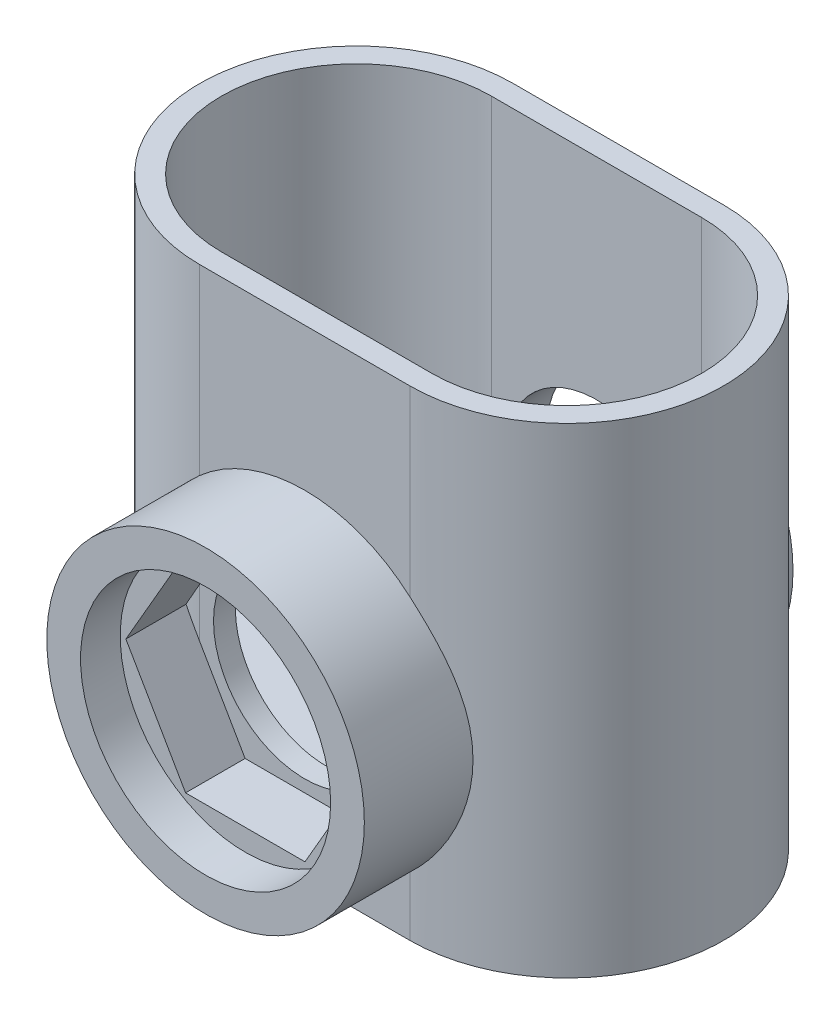
from build123d import *

# Parameters (mm, degrees)
EXTRUDE_1_DEPTH     = 24.2
EXTRUDE_2_REACH     = 38.885
SKETCH_2_R          = 8
SKETCH_7_R          = 6.3
CUT_EXTRUDE_5_DEPTH = 2
SKETCH_8_R          = 4.6
CUT_EXTRUDE_6_DEPTH = 37.885363123
EXTRUDE_START       = 1
SKETCH_8_3_R        = 7.8
SKETCH_8_3_R_2      = 4.6
EXTRUDE_3_DEPTH     = 1
CUT_EXTRUDE_7_DEPTH = 22.6


with BuildPart() as part:
    # 草圖1 → 填料-伸長1 (new body)
    with BuildSketch(Plane(origin=(0, 0, 0), x_dir=(1, 0, 0), z_dir=(0, 1, 0))):
        with BuildLine():
            Line((0, 7.9), (10.6, 7.9))
            ThreePointArc((10.6, 7.9), (18.5, 0), (10.6, -7.9))
            Line((10.6, -7.9), (0, -7.9))
            ThreePointArc((0, -7.9), (-7.9, 0), (0, 7.9))
        make_face()
    extrude(amount=EXTRUDE_1_DEPTH)

    # 草圖2 → 填料-伸長2 (add, up to next)
    with BuildSketch(Plane.XY.offset(12.9), mode=Mode.PRIVATE) as extrude_2_sk1:
        with Locations((5.3, 9)):
            Circle(SKETCH_2_R)
        Polygon((8.307994902, 14.21), (2.292005098, 14.21), (-0.715989805, 9), (2.292005098, 3.79), (8.307994902, 3.79), (11.315989805, 9), align=None, mode=Mode.SUBTRACT)
    extrude_2_tool1 = extrude(extrude_2_sk1.sketch, amount=-EXTRUDE_2_REACH, mode=Mode.PRIVATE) - part.part
    add(extrude_2_tool1.solids().sort_by_distance((-2.473726, 9, 12.9))[0])

    # 草圖7 → 除料-伸長5 (cut)
    with BuildSketch(Plane.XY.offset(12.9)):
        with Locations((5.3, 9)):
            Circle(SKETCH_7_R)
    extrude(amount=-CUT_EXTRUDE_5_DEPTH, mode=Mode.SUBTRACT)

    # 草圖8 → 除料-伸長6 (cut, through all)
    with BuildSketch(Plane(origin=(0, 0, -7.9), x_dir=(-1, 0, 0), z_dir=(0, 0, -1))):
        with Locations((-5.3, 9)):
            Circle(SKETCH_8_R)
    extrude(amount=-CUT_EXTRUDE_6_DEPTH, mode=Mode.SUBTRACT)

    # 草圖8<3> → 填料-伸長3 (add)
    with BuildSketch(Plane(origin=(0, 0, -7.9), x_dir=(-1, 0, 0), z_dir=(0, 0, -1)).offset(EXTRUDE_START)):
        with Locations((-5.3, 9)):
            Circle(SKETCH_8_3_R)
        with Locations((-5.3, 9)):
            Circle(SKETCH_8_3_R_2, mode=Mode.SUBTRACT)
    extrude(amount=-EXTRUDE_3_DEPTH)

    # 草圖9 → 除料-伸長7 (cut)
    with BuildSketch(Plane(origin=(0, 24.2, 0), x_dir=(1, 0, 0), z_dir=(0, 1, 0))):
        with BuildLine():
            ThreePointArc((10.6, -6.8), (17.4, 0), (10.6, 6.8))
            Line((10.6, 6.8), (0, 6.8))
            ThreePointArc((0, 6.8), (-6.8, 0), (0, -6.8))
            Line((0, -6.8), (10.6, -6.8))
        make_face()
    extrude(amount=-CUT_EXTRUDE_7_DEPTH, mode=Mode.SUBTRACT)


solid = part.part
